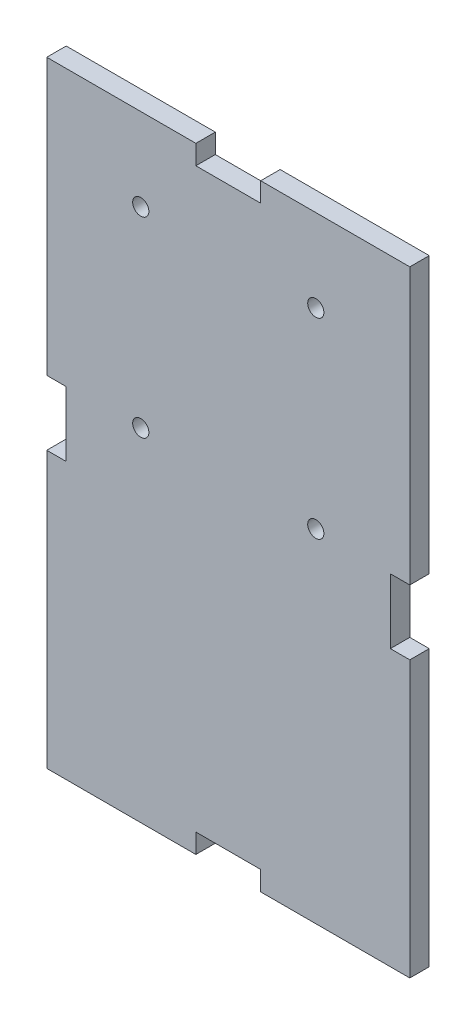
from build123d import *

# Parameters (mm, degrees)
BOSS_EXTRUDE1_DEPTH = 3
SKETCH2_R           = 1.25
CUT_EXTRUDE1_DEPTH  = 3


with BuildPart() as part:
    # Sketch1 → Boss-Extrude1 (new body)
    with BuildSketch(Plane.XY):
        Polygon((28.129269299, -5.5398317), (28.129269299, -48.0398317), (25.129269299, -48.0398317), (5.129269299, -48.0398317), (5.129269299, -45.0398317), (-4.870730701, -45.0398317), (-4.870730701, -48.0398317), (-24.870730701, -48.0398317), (-27.870730701, -48.0398317), (-27.870730701, -5.5398317), (-24.870730701, -5.5398317), (-24.870730701, 4.4601683), (-27.870730701, 4.4601683), (-27.870730701, 46.9601683), (-24.870730701, 46.9601683), (-4.870730701, 46.9601683), (-4.870730701, 43.9601683), (5.129269299, 43.9601683), (5.129269299, 46.9601683), (25.129269299, 46.9601683), (28.129269299, 46.9601683), (28.129269299, 4.4601683), (25.129269299, 4.4601683), (25.129269299, -5.5398317), align=None)
    extrude(amount=BOSS_EXTRUDE1_DEPTH)

    # Sketch2 → Cut-Extrude1 (cut)
    with BuildSketch(Plane.XY.offset(3)):
        with Locations((13.629269299, 34.2257933)):
            Circle(SKETCH2_R)
        with Locations((13.629269299, 4.6945433)):
            Circle(SKETCH2_R)
        with Locations((-13.370730701, 34.2257933)):
            Circle(SKETCH2_R)
        with Locations((-13.370730701, 4.6945433)):
            Circle(SKETCH2_R)
    extrude(amount=-CUT_EXTRUDE1_DEPTH, mode=Mode.SUBTRACT)


solid = part.part
